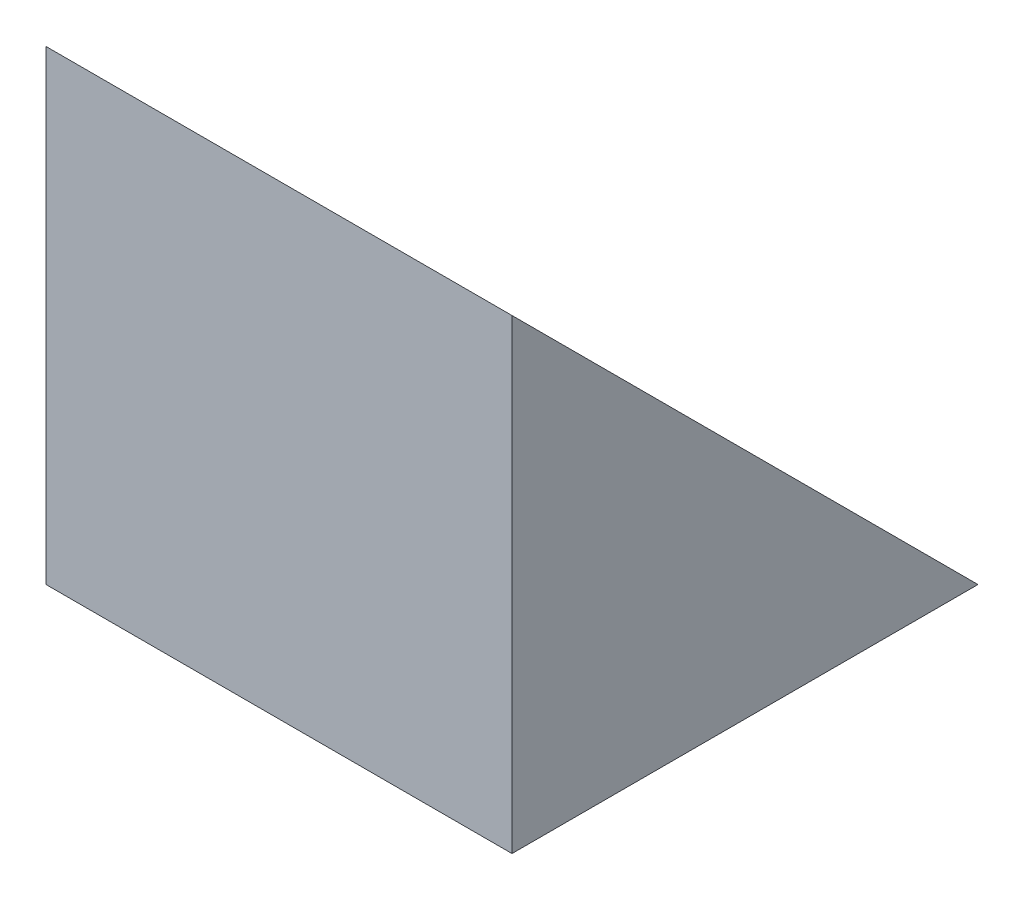
from build123d import *

# Parameters (mm, degrees)
BOSS_EXTRUDE1_DEPTH = 40
SKETCH3_W           = 36
SKETCH3_H           = 38
CUT_EXTRUDE1_DEPTH  = 36
CUT_EXTRUDE2_REACH  = 70.147
SKETCH4_R           = 3


with BuildPart() as part:
    # Sketch1 → Boss-Extrude1 (new body)
    with BuildSketch(Plane(origin=(0, 0, 0), x_dir=(0, 0, -1), z_dir=(1, 0, 0))):
        Polygon((0, 0), (0, 40), (40, 0), align=None)
    extrude(amount=BOSS_EXTRUDE1_DEPTH)

    # Sketch3 → Cut-Extrude1 (cut)
    with BuildSketch(Plane.XY.offset(-40)):
        with Locations((20, 21)):
            Rectangle(SKETCH3_W, SKETCH3_H)
    extrude(amount=CUT_EXTRUDE1_DEPTH, mode=Mode.SUBTRACT)

    # Sketch4 → Cut-Extrude2 (cut, up to next)
    with BuildSketch(Plane(origin=(0, 2, 0), x_dir=(1, 0, 0), z_dir=(0, 1, 0)), mode=Mode.PRIVATE) as cut_extrude2_sk1:
        with Locations(Location((20, 21, 0), (0, 0, 270))):
            Circle(SKETCH4_R)
    cut_extrude2_tool1 = extrude(cut_extrude2_sk1.sketch, amount=-CUT_EXTRUDE2_REACH, mode=Mode.PRIVATE) & part.part
    add(cut_extrude2_tool1.solids().sort_by_distance((20, 2, -21))[0], mode=Mode.SUBTRACT)


solid = part.part
